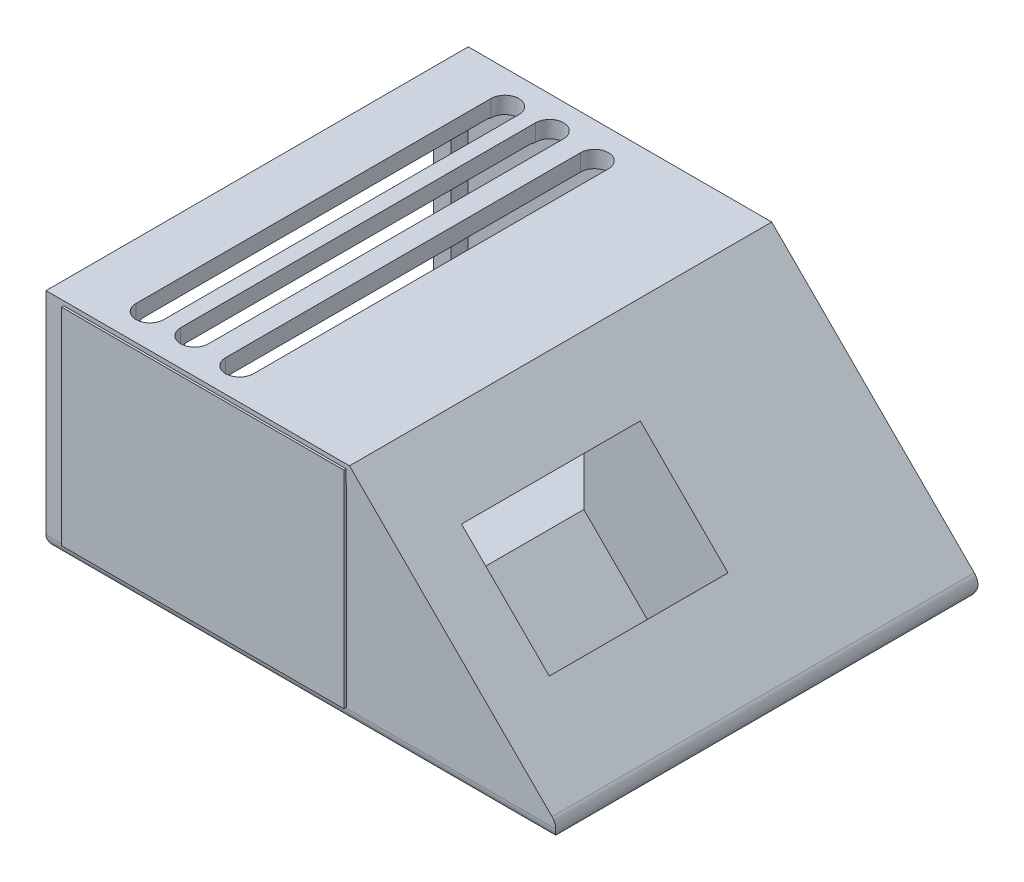
from build123d import *

# Parameters (mm, degrees)
Y_KSEKLIK_EKSTR_ZYON1_DEPTH = 84.582
IZIM2_W                     = 56.613252044
IZIM2_H                     = 38.905458561
KES_EKSTR_ZYON1_DEPTH       = 84.582
IZIM3_W                     = 24.859999106
IZIM3_H                     = 35.80382045
KES_EKSTR_ZYON2_DEPTH       = 22.86
IZIM4_W                     = 56.56840029
IZIM4_H                     = 3.7507773
Y_KSEKLIK_EKSTR_ZYON3_DEPTH = 41.402
IZIM5_W                     = 56.873307594
IZIM5_H                     = 3.441337166
Y_KSEKLIK_EKSTR_ZYON4_DEPTH = 41.402
KES_EKSTR_ZYON3_DEPTH       = 20.828
IZIM7_W                     = 69.770370065
IZIM7_H                     = 38.93587287
KES_EKSTR_ZYON4_DEPTH       = 20.828
RADYUS1_R                   = 2.54


with BuildPart() as part:
    # Çizim1 → Yükseklik-Ekstrüzyon1 (new body)
    with BuildSketch(Plane.XY):
        Polygon((-100.117298217, 48.908980301), (-39.325061833, 48.908980301), (5.581137472, 4.002780997), (-100.117298217, 4.002780997), align=None)
    extrude(amount=Y_KSEKLIK_EKSTR_ZYON1_DEPTH)

    # Çizim2 → Kes-Ekstrüzyon1 (cut)
    with BuildSketch(Plane.XY.offset(84.582)):
        with Locations((-68.275200444, 26.094986488)):
            Rectangle(IZIM2_W, IZIM2_H)
    extrude(amount=-KES_EKSTR_ZYON1_DEPTH, mode=Mode.SUBTRACT)

    # Çizim3 → Kes-Ekstrüzyon2 (cut)
    with BuildSketch(Plane(origin=(4.791959234, 4.791959234, 0), x_dir=(0.7071067811865521, -0.7071067811865429, 0), z_dir=(0.7071067811865429, 0.7071067811865521, 0))):
        with Locations((-34.88056776, -54.904893427)):
            Rectangle(IZIM3_W, IZIM3_H)
    extrude(amount=-KES_EKSTR_ZYON2_DEPTH, mode=Mode.SUBTRACT)

    # Çizim4 → Yükseklik-Ekstrüzyon3 (add)
    with BuildSketch(Plane(origin=(0, 6.642257207, 0.5213718), x_dir=(1, 0, 0), z_dir=(0, 1, 0))):
        with Locations((-68.26547223, -82.621441536)):
            Rectangle(IZIM4_W, IZIM4_H)
    extrude(amount=Y_KSEKLIK_EKSTR_ZYON3_DEPTH)

    # Çizim5 → Yükseklik-Ekstrüzyon4 (add)
    with BuildSketch(Plane(origin=(0, 6.642257207, 0), x_dir=(1, 0, 0), z_dir=(0, 1, 0))):
        with Locations((-68.314463999, -1.839596634)):
            Rectangle(IZIM5_W, IZIM5_H)
    extrude(amount=Y_KSEKLIK_EKSTR_ZYON4_DEPTH)

    # Çizim6 → Kes-Ekstrüzyon3 (cut)
    with BuildSketch(Plane(origin=(0, 48.908980301, 0), x_dir=(1, 0, 0), z_dir=(0, 1, 0))):
        with BuildLine():
            Line((-88.870816985, -77.80498522), (-88.870816985, -6.700388759))
            ThreePointArc((-88.870816985, -6.700388759), (-86.078686723, -3.908258497), (-83.286556461, -6.700388759))
            Line((-83.286556461, -6.700388759), (-83.286556461, -77.80498522))
            ThreePointArc((-83.286556461, -77.80498522), (-86.078686723, -80.597115482), (-88.870816985, -77.80498522))
        make_face()
        with BuildLine():
            Line((-80.201988502, -77.524018239), (-80.201988502, -6.419421778))
            ThreePointArc((-80.201988502, -6.419421778), (-77.40985824, -3.627291516), (-74.617727978, -6.419421778))
            Line((-74.617727978, -6.419421778), (-74.617727978, -77.524018239))
            ThreePointArc((-74.617727978, -77.524018239), (-77.40985824, -80.316148501), (-80.201988502, -77.524018239))
        make_face()
        with BuildLine():
            Line((-70.501383696, -78.211655362), (-70.501383696, -7.107058901))
            ThreePointArc((-70.501383696, -7.107058901), (-67.709253434, -4.314928639), (-64.917123172, -7.107058901))
            Line((-64.917123172, -7.107058901), (-64.917123172, -78.211655362))
            ThreePointArc((-64.917123172, -78.211655362), (-67.709253434, -81.003785624), (-70.501383696, -78.211655362))
        make_face()
    extrude(amount=-KES_EKSTR_ZYON3_DEPTH, mode=Mode.SUBTRACT)

    # Çizim7 → Kes-Ekstrüzyon4 (cut)
    with BuildSketch(Plane.ZY.offset(100.117298217)):
        with Locations((41.890344752, 26.266043038)):
            Rectangle(IZIM7_W, IZIM7_H)
    extrude(amount=-KES_EKSTR_ZYON4_DEPTH, mode=Mode.SUBTRACT)

    # Radyus1
    radyus1_edges = [part.edges().sort_by_distance(p)[0] for p in [
        (-47.268080373, 4.002780997, 0),
        (-47.268080373, 4.002780997, 84.582),
        (5.581137472, 4.002780997, 42.291),
        (-100.117298217, 4.002780997, 42.291),
    ]]
    fillet(radyus1_edges, radius=RADYUS1_R)


solid = part.part
